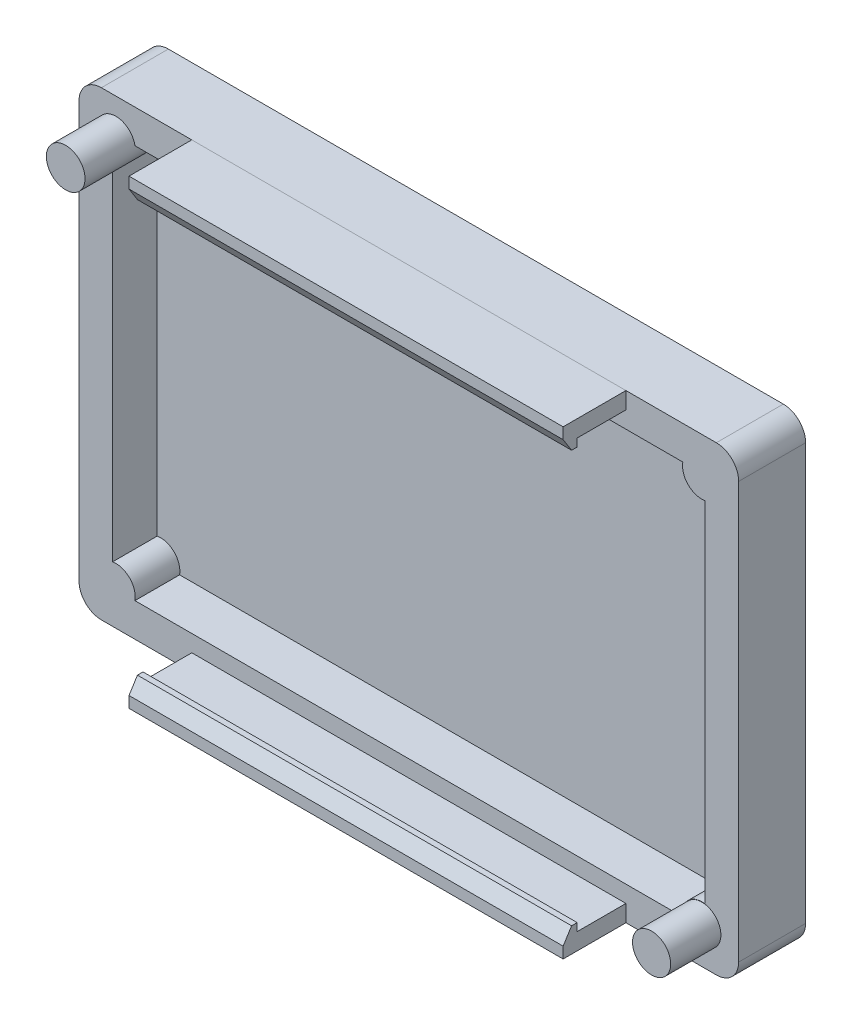
from build123d import *
from build123d.topology import SkipClean

# Parameters (mm, degrees)
SZKIC1_W                    = 59.100010001
SZKIC1_H                    = 41.299998987
DODANIE_WYCI_GNI_CIE1_DEPTH = 6
SZKIC2_W                    = 59.100010001
SZKIC2_H                    = 41.299998987
DODANIE_WYCI_GNI_CIE2_DEPTH = 2
DODANIE_WYCI_GNI_CIE3_DEPTH = 49
WYTNIJ_WYCI_GNI_CIE2_DEPTH  = 10.1
SZKIC10_R                   = 1.708928953
SZKIC10_R_2                 = 1.732000006
DODANIE_WYCI_GNI_CIE4_DEPTH = 4.5
ZAOKR_GLENIE2_R             = 2


with BuildPart() as part:
    # Szkic1 → Dodanie-wyciągnięcie1 (new body)
    with BuildSketch(Plane(origin=(0, 0, 48.142497501), x_dir=(-1, 0, 0), z_dir=(0, 0, -1))):
        with Locations((-0.56091645, -0.813328838)):
            Rectangle(SZKIC1_W, SZKIC1_H)
        with BuildLine():
            ThreePointArc((-27.11092145, 14.830852979), (-25.586268211, 15.311972573), (-25.105290748, 16.836670655))
            Line((-25.105290748, 16.836670655), (23.983285891, 16.836670655))
            ThreePointArc((23.983285891, 16.836670655), (24.464316114, 15.311856195), (25.989088551, 14.830692784))
            Line((25.989088551, 14.830692784), (25.989088551, -16.45750804))
            ThreePointArc((25.989088551, -16.45750804), (24.464318208, -16.938605941), (23.983068356, -18.463328332))
            Line((23.983068356, -18.463328332), (-25.105072686, -18.463328332))
            ThreePointArc((-25.105072686, -18.463328332), (-25.586269943, -16.938721956), (-27.11092145, -16.457667715))
            Line((-27.11092145, -16.457667715), (-27.11092145, 14.830852979))
        make_face(mode=Mode.SUBTRACT)
    extrude(amount=-DODANIE_WYCI_GNI_CIE1_DEPTH)

    # Szkic2 → Dodanie-wyciągnięcie2 (add)
    with BuildSketch(Plane(origin=(0, 0, 48.142497501), x_dir=(-1, 0, 0), z_dir=(0, 0, -1))):
        with Locations((-0.56091645, -0.813328838)):
            Rectangle(SZKIC2_W, SZKIC2_H)
    extrude(amount=-DODANIE_WYCI_GNI_CIE2_DEPTH)

    # Szkic10 → Dodanie-wyciągnięcie4 (add)
    with SkipClean():  # the faces are left unmerged after this step: merging them gives an invalid solid
        with BuildSketch(Plane.XY.offset(54.142497501)):
            with Locations((26.81092145, -18.163488345)):
                Circle(SZKIC10_R)
            with Locations((-25.68907855, 16.536511655)):
                Circle(SZKIC10_R_2)
        extrude(amount=DODANIE_WYCI_GNI_CIE4_DEPTH)

    # Zaokrąglenie2
    zaokr_glenie2_edges = [part.edges().sort_by_distance(p)[0] for p in [
        (-28.989088551, 19.836670655, 51.142497501),
        (30.11092145, 19.836670655, 51.142497501),
        (30.11092145, -21.463328332, 51.142497501),
        (-28.989088551, -21.463328332, 51.142497501),
    ]]
    fillet(zaokr_glenie2_edges, radius=ZAOKR_GLENIE2_R)


with BuildPart() as body_2:
    # Szkic5 → Dodanie-wyciągnięcie3 (new body)
    with BuildSketch(Plane(origin=(30.11092145, 0, 0), x_dir=(0, 0, -1), z_dir=(1, 0, 0))):
        Polygon((-54.142497501, 19.836670655), (-59.768947352, 19.836670655), (-59.768947352, 18.836670655), (-59.012699001, 17.636670655), (-58.512699001, 17.636670655), (-58.512699001, 18.336670655), (-54.142497501, 18.336670655), align=None)
    extrude(amount=-DODANIE_WYCI_GNI_CIE3_DEPTH)

    # Szkic5<2> → Wytnij-wyciągnięcie2 (cut)
    with BuildSketch(Plane(origin=(30.11092145, 0, 0), x_dir=(0, 0, -1), z_dir=(1, 0, 0))):
        Polygon((-54.142497501, 19.836670655), (-59.768947352, 19.836670655), (-59.768947352, 18.836670655), (-59.012699001, 17.636670655), (-58.512699001, 17.636670655), (-58.512699001, 18.336670655), (-54.142497501, 18.336670655), align=None)
    extrude(amount=-WYTNIJ_WYCI_GNI_CIE2_DEPTH, mode=Mode.SUBTRACT)


with BuildPart() as body_3:
    # Lustro3: mirrored copy
    add(body_2.part.mirror(Plane(origin=(0, -0.813328839, 0), x_dir=(0, 0, 1), z_dir=(0, -1, 0))))


solid = Compound([part.part, body_2.part, body_3.part])
